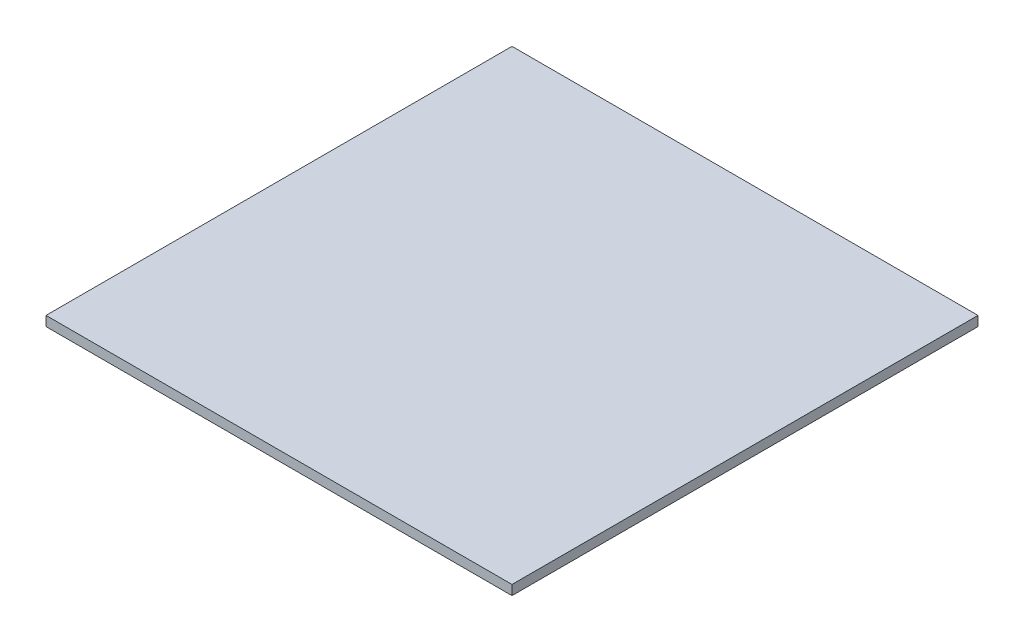
from build123d import *

# Parameters (mm, degrees)
SKETCH1_W           = 304.8
SKETCH1_H           = 304.8
BOSS_EXTRUDE1_DEPTH = 6.35


with BuildPart() as part:
    # Sketch1 → Boss-Extrude1 (new body)
    with BuildSketch(Plane(origin=(0, 0, 0), x_dir=(1, 0, 0), z_dir=(0, 1, 0))):
        with Locations((36.383783784, -27.802702703)):
            Rectangle(SKETCH1_W, SKETCH1_H)
    extrude(amount=BOSS_EXTRUDE1_DEPTH)


solid = part.part
